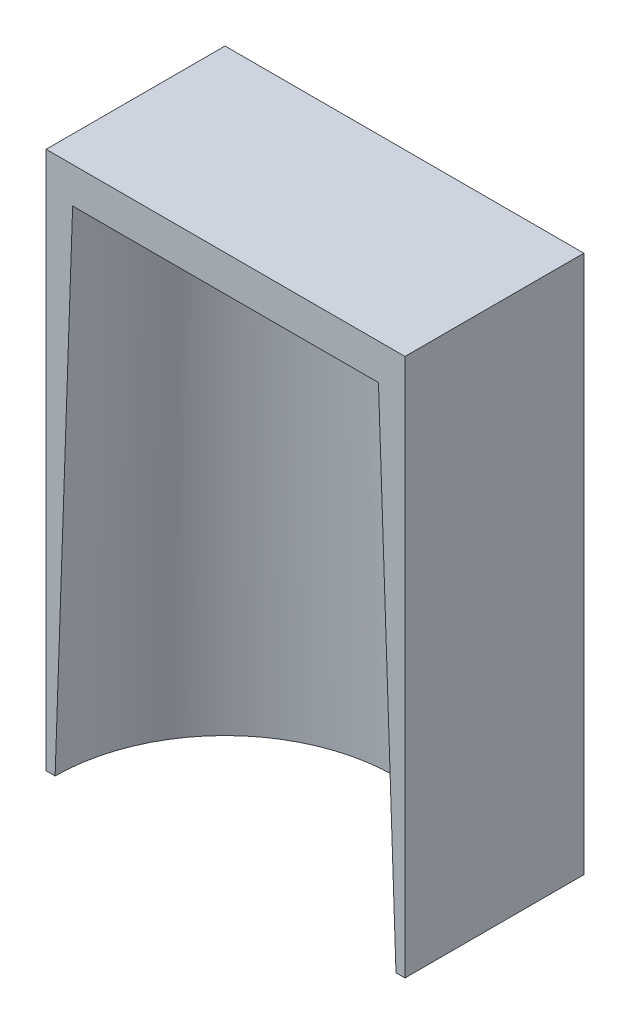
from build123d import *

# Parameters (mm, degrees)
SKETCH1_W           = 100
SKETCH1_H           = 49.852187789
BOSS_EXTRUDE3_DEPTH = 150
SKETCH2_R           = 47.5
CUT_EXTRUDE1_DEPTH  = 140
CUT_EXTRUDE1_DRAFT  = -2


with BuildPart() as part:
    # Sketch1 → Boss-Extrude3 (new body)
    with BuildSketch(Plane(origin=(0, 0, 0), x_dir=(1, 0, 0), z_dir=(0, 1, 0))):
        with Locations((0, 25.073906106)):
            Rectangle(SKETCH1_W, SKETCH1_H)
    extrude(amount=BOSS_EXTRUDE3_DEPTH)


with BuildPart() as cut_extrude1_tool:
    # Sketch2 → Cut-Extrude1 (with draft: the straight prism first)
    with BuildSketch(Plane.XZ):
        Circle(SKETCH2_R)
    extrude(amount=-CUT_EXTRUDE1_DEPTH)
    # Cut-Extrude1: the draft: its side faces are tilted about the plane it starts from
    cut_extrude1_sides = [cut_extrude1_tool.faces().sort_by_distance(p)[0] for p in [
        (-47.5, 70, 0),
    ]]
    draft(cut_extrude1_sides, Plane.XZ, CUT_EXTRUDE1_DRAFT)


with BuildPart() as part_1:
    add(part.part)

    # Cut-Extrude1: cut by cut_extrude1_tool
    add(cut_extrude1_tool.part, mode=Mode.SUBTRACT)


solid = part_1.part
